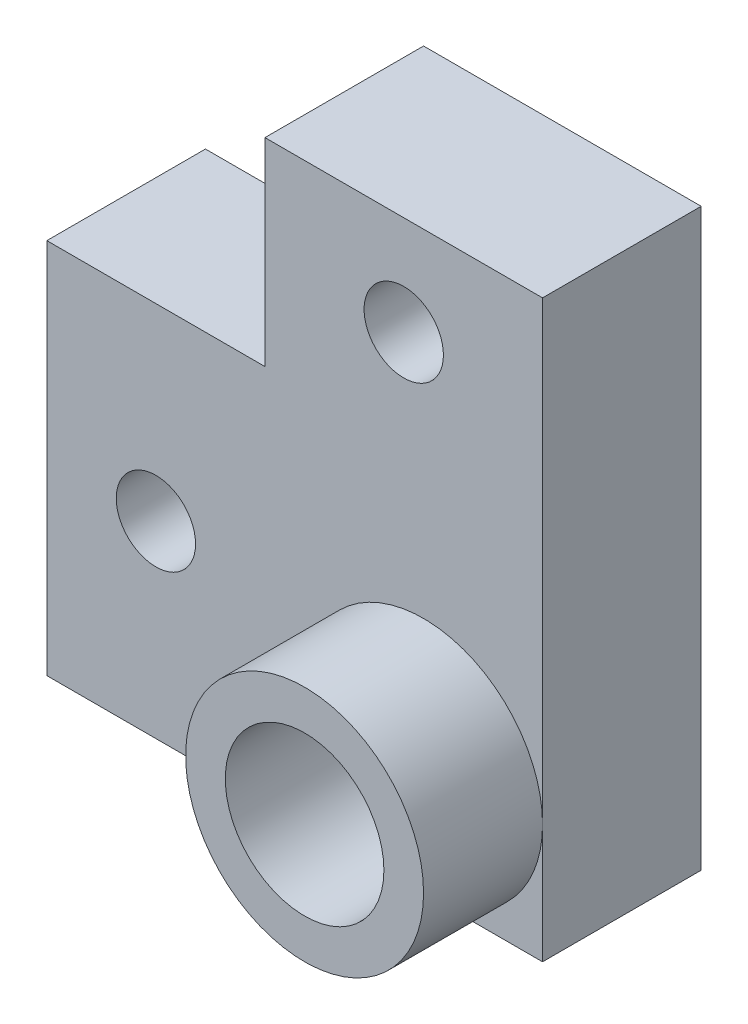
from build123d import *

# Parameters (mm, degrees)
SKETCH1_W           = 25
SKETCH1_H           = 19
BOSS_EXTRUDE1_DEPTH = 8
SKETCH2_W           = 14
SKETCH2_H           = 8
BOSS_EXTRUDE2_DEPTH = 10
SKETCH3_R           = 2
CUT_EXTRUDE1_DEPTH  = 20
SKETCH4_R           = 4
CUT_EXTRUDE2_DEPTH  = 20
BOSS_EXTRUDE3_START = 6
SKETCH5_R           = 6
SKETCH5_R_2         = 4
BOSS_EXTRUDE3_DEPTH = 6


with BuildPart() as part:
    # Sketch1 → Boss-Extrude1 (new body)
    with BuildSketch(Plane.XY):
        with Locations((-0.294701987, 2.413907285)):
            Rectangle(SKETCH1_W, SKETCH1_H)
    extrude(amount=BOSS_EXTRUDE1_DEPTH)

    # Sketch2 → Boss-Extrude2 (add)
    with BuildSketch(Plane(origin=(0, 11.913907285, 0), x_dir=(1, 0, 0), z_dir=(0, 1, 0))):
        with Locations((5.205298013, -4)):
            Rectangle(SKETCH2_W, SKETCH2_H)
    extrude(amount=BOSS_EXTRUDE2_DEPTH)

    # Sketch3 → Cut-Extrude1 (cut)
    with BuildSketch(Plane.XY.offset(8)):
        with Locations((-7.294701987, 2.413907285)):
            Circle(SKETCH3_R)
        with Locations((5.205298013, 16.913907285)):
            Circle(SKETCH3_R)
    extrude(amount=-CUT_EXTRUDE1_DEPTH, mode=Mode.SUBTRACT)

    # Sketch4 → Cut-Extrude2 (cut)
    with BuildSketch(Plane.XY.offset(8)):
        with Locations((6.205298013, -1.086092715)):
            Circle(SKETCH4_R)
    extrude(amount=-CUT_EXTRUDE2_DEPTH, mode=Mode.SUBTRACT)

    # Sketch5 → Boss-Extrude3 (add)
    with BuildSketch(Plane.XY.offset(8).offset(BOSS_EXTRUDE3_START)):
        with Locations((6.205298013, -1.086092715)):
            Circle(SKETCH5_R)
        with Locations((6.205298013, -1.086092715)):
            Circle(SKETCH5_R_2, mode=Mode.SUBTRACT)
    extrude(amount=-BOSS_EXTRUDE3_DEPTH)


solid = part.part
